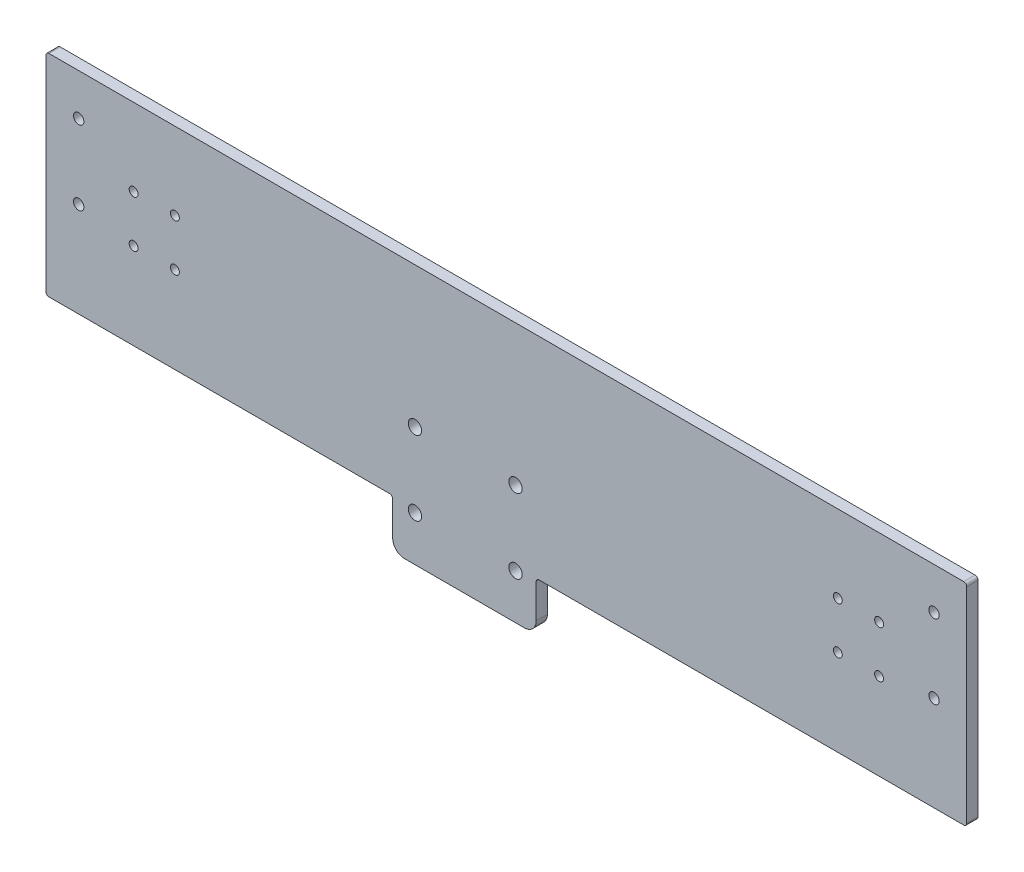
from build123d import *

# Parameters (mm, degrees)
SKETCH1_R           = 1.75
SKETCH1_R_2         = 2.25
SKETCH1_R_3         = 1.5
BOSS_EXTRUDE1_DEPTH = 3.8


with BuildPart() as part:
    # Sketch1 → Boss-Extrude1 (new body)
    with BuildSketch(Plane.XY):
        with BuildLine():
            Line((299, -10.001863855), (156.039811852, -10.001863855))
            ThreePointArc((156.039811852, -10.001863855), (155.33270507, -10.294757074), (155.039811852, -11.001863855))
            Line((155.039811852, -11.001863855), (155.039811852, -22.458474266))
            ThreePointArc((155.039811852, -22.458474266), (153.868238976, -25.286901391), (151.039811852, -26.458474266))
            Line((151.039811852, -26.458474266), (110.724043242, -26.458474266))
            ThreePointArc((110.724043242, -26.458474266), (107.895616117, -25.286901391), (106.724043242, -22.458474266))
            Line((106.724043242, -22.458474266), (106.724043242, -11.001863855))
            ThreePointArc((106.724043242, -11.001863855), (106.431150023, -10.294757074), (105.724043242, -10.001863855))
            Line((105.724043242, -10.001863855), (-9, -10.001863855))
            ThreePointArc((-9, -10.001863855), (-9.707106781, -9.708970637), (-10, -9.001863855))
            Line((-10, -9.001863855), (-10, 60))
            ThreePointArc((-10, 60), (-9.707106781, 60.707106781), (-9, 61))
            Line((-9, 61), (299, 61))
            ThreePointArc((299, 61), (299.707106781, 60.707106781), (300, 60))
            Line((300, 60), (300, -9.001863855))
            ThreePointArc((300, -9.001863855), (299.707106781, -9.708970637), (299, -10.001863855))
        make_face()
        with Locations(Location((289, 22.001504258, 0), (0, 0, 180))):
            Circle(SKETCH1_R, mode=Mode.SUBTRACT)
        with Locations(Location((289, 47.001504258, 0), (0, 0, 180))):
            Circle(SKETCH1_R, mode=Mode.SUBTRACT)
        with Locations(Location((148.082820817, -11.316051766, 0), (0, 0, 180))):
            Circle(SKETCH1_R_2, mode=Mode.SUBTRACT)
        with Locations(Location((148.082820817, 13.683948234, 0), (0, 0, 180))):
            Circle(SKETCH1_R_2, mode=Mode.SUBTRACT)
        with Locations(Location((114.224914373, 13.683948234, 0), (0, 0, 180))):
            Circle(SKETCH1_R_2, mode=Mode.SUBTRACT)
        with Locations(Location((114.224914373, -11.316051766, 0), (0, 0, 180))):
            Circle(SKETCH1_R_2, mode=Mode.SUBTRACT)
        with Locations(Location((256.6, 19.147207957, 0), (0, 0, 180))):
            Circle(SKETCH1_R_3, mode=Mode.SUBTRACT)
        with Locations(Location((270.5, 19.147207957, 0), (0, 0, 180))):
            Circle(SKETCH1_R_3, mode=Mode.SUBTRACT)
        with Locations(Location((270.5, 34.947207957, 0), (0, 0, 180))):
            Circle(SKETCH1_R_3, mode=Mode.SUBTRACT)
        with Locations(Location((256.6, 34.947207957, 0), (0, 0, 180))):
            Circle(SKETCH1_R_3, mode=Mode.SUBTRACT)
        with Locations(Location((33.4, 34.947207957, 0), (0, 0, 180))):
            Circle(SKETCH1_R_3, mode=Mode.SUBTRACT)
        with Locations(Location((19.5, 34.947207957, 0), (0, 0, 180))):
            Circle(SKETCH1_R_3, mode=Mode.SUBTRACT)
        with Locations(Location((19.5, 19.147207957, 0), (0, 0, 180))):
            Circle(SKETCH1_R_3, mode=Mode.SUBTRACT)
        with Locations(Location((33.4, 19.147207957, 0), (0, 0, 180))):
            Circle(SKETCH1_R_3, mode=Mode.SUBTRACT)
        with Locations(Location((1, 47.001504258, 0), (0, 0, 180))):
            Circle(SKETCH1_R, mode=Mode.SUBTRACT)
        with Locations(Location((1, 22.001504258, 0), (0, 0, 180))):
            Circle(SKETCH1_R, mode=Mode.SUBTRACT)
    extrude(amount=BOSS_EXTRUDE1_DEPTH)


solid = part.part
